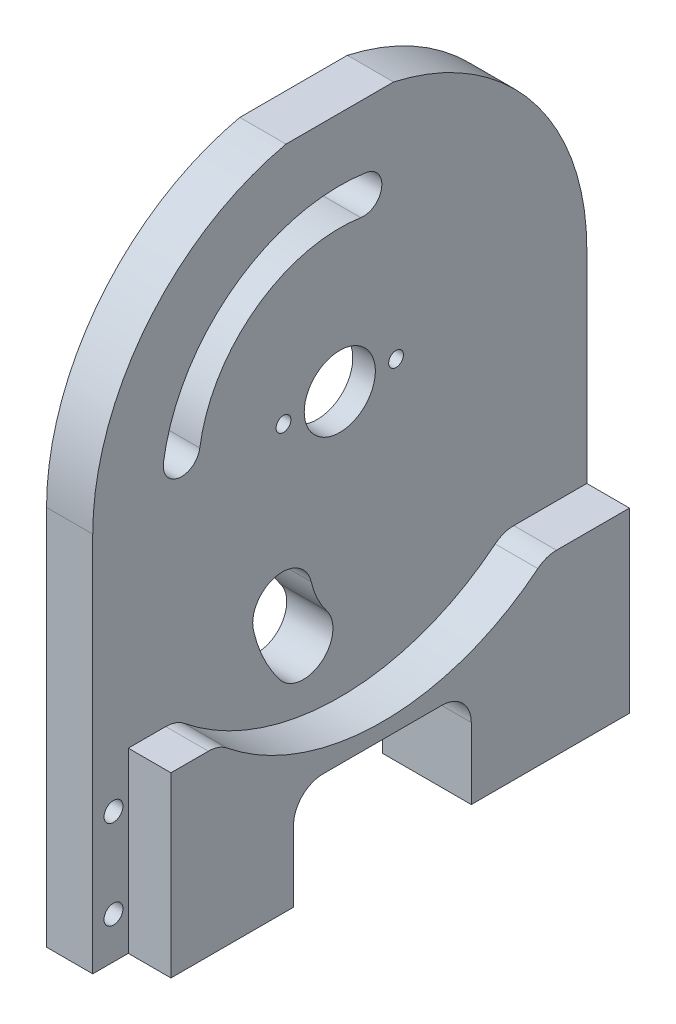
from build123d import *

# Parameters (mm, degrees)
SKETCH_1_W           = 7.8
SKETCH_1_H           = 83.4
EXTRUDE_1_DEPTH      = 105
CUT_EXTRUDE_1_DEPTH  = 135.318278726
SKETCH_3_R           = 6
CUT_EXTRUDE_2_DEPTH  = 135.318278726
SKETCH_4_R           = 13.6
CUT_EXTRUDE_3_DEPTH  = 4
SKETCH_5_R           = 1.25
CUT_EXTRUDE_4_DEPTH  = 4
EXTRUDE_2_DEPTH      = 7.2
SKETCH_7_W           = 6
SKETCH_7_H           = 30
CUT_EXTRUDE_5_DEPTH  = 7.2
CUT_EXTRUDE_6_DEPTH  = 135.92798079
SKETCH_9_R           = 1.65
CUT_EXTRUDE_7_DEPTH  = 15
CUT_EXTRUDE_8_DEPTH  = 135.92798079
FILLET_1_R           = 5
CUT_EXTRUDE_10_DEPTH = 135.92798079
SKETCH_16_R          = 1.6
CUT_EXTRUDE_11_DEPTH = 135.92798079
SKETCH_17_R          = 3
CUT_EXTRUDE_12_DEPTH = 2


with BuildPart() as part:
    # 草图1 → 凸台-拉伸1 (new body)
    with BuildSketch(Plane(origin=(0, 0, 0), x_dir=(1, 0, 0), z_dir=(0, 1, 0))):
        with Locations((3.9, -41.7)):
            Rectangle(SKETCH_1_W, SKETCH_1_H)
    extrude(amount=EXTRUDE_1_DEPTH)

    # 草图2 → 切除-拉伸1 (cut, through all)
    with BuildSketch(Plane.ZY):
        with BuildLine():
            Line((0, 64.3), (0, 105))
            Line((0, 105), (32.622555426, 105))
            ThreePointArc((32.622555426, 105), (9.162180169, 90.380266115), (0, 64.3))
        make_face()
        with BuildLine():
            Line((83.4, 105), (83.4, 64.3))
            ThreePointArc((83.4, 64.3), (74.237819831, 90.380266115), (50.777444574, 105))
            Line((50.777444574, 105), (83.4, 105))
        make_face()
    extrude(amount=-CUT_EXTRUDE_1_DEPTH, mode=Mode.SUBTRACT)

    # 草图3 → 切除-拉伸2 (cut, through all)
    with BuildSketch(Plane.ZY):
        with Locations((41.7, 64.3)):
            Circle(SKETCH_3_R)
    extrude(amount=-CUT_EXTRUDE_2_DEPTH, mode=Mode.SUBTRACT)

    # 草图4 → 切除-拉伸3 (cut)
    with BuildSketch(Plane.ZY):
        with Locations((41.7, 64.3)):
            Circle(SKETCH_4_R)
    extrude(amount=-CUT_EXTRUDE_3_DEPTH, mode=Mode.SUBTRACT)

    # 草图5 → 切除-拉伸4 (cut)
    with BuildSketch(Plane.ZY.offset(-4)):
        with Locations((32.2, 64.3)):
            Circle(SKETCH_5_R)
        with Locations((51.2, 64.3)):
            Circle(SKETCH_5_R)
    extrude(amount=-CUT_EXTRUDE_4_DEPTH, mode=Mode.SUBTRACT)

    # 草图6 → 凸台-拉伸2 (add)
    with BuildSketch(Plane(origin=(7.8, 0, 0), x_dir=(0, 0, -1), z_dir=(1, 0, 0))):
        with BuildLine():
            ThreePointArc((-14.146415841, 30), (-26.974511893, 22.286540784), (-41.7, 19.6))
            Line((-41.7, 19.6), (-41.7, 0))
            Line((-41.7, 0), (0, 0))
            Line((0, 0), (0, 30))
            Line((0, 30), (-14.146415841, 30))
        make_face()
        with BuildLine():
            Line((-41.7, 0), (-41.7, 19.6))
            ThreePointArc((-41.7, 19.6), (-56.425488107, 22.286540784), (-69.253584159, 30))
            Line((-69.253584159, 30), (-83.4, 30))
            Line((-83.4, 30), (-83.4, 0))
            Line((-83.4, 0), (-41.7, 0))
        make_face()
    extrude(amount=EXTRUDE_2_DEPTH)

    # 草图7 → 切除-拉伸5 (cut)
    with BuildSketch(Plane(origin=(15, 0, 0), x_dir=(0, 0, -1), z_dir=(1, 0, 0))):
        with Locations((-80.4, 15)):
            Rectangle(SKETCH_7_W, SKETCH_7_H)
    extrude(amount=-CUT_EXTRUDE_5_DEPTH, mode=Mode.SUBTRACT)

    # 草图8 → 切除-拉伸6 (cut, through all)
    with BuildSketch(Plane.ZY):
        with BuildLine():
            Line((31.7, 17), (51.7, 17))
            ThreePointArc((51.7, 17), (55.235533906, 15.535533906), (56.7, 12))
            Line((56.7, 12), (56.7, 0))
            Line((56.7, 0), (26.7, 0))
            Line((26.7, 0), (26.7, 12))
            ThreePointArc((26.7, 12), (28.164466094, 15.535533906), (31.7, 17))
        make_face()
    extrude(amount=-CUT_EXTRUDE_6_DEPTH, mode=Mode.SUBTRACT)

    # 草图9 → 切除-拉伸7 (cut)
    with BuildSketch(Plane.XZ):
        with Locations(Location((7.5, 73.4, 0), (0, 0, 270))):
            Circle(SKETCH_9_R)
        with Locations(Location((7.5, 62.7, 0), (0, 0, 270))):
            Circle(SKETCH_9_R)
        with Locations(Location((7.5, 20.7, 0), (0, 0, 270))):
            Circle(SKETCH_9_R)
        with Locations(Location((7.5, 6, 0), (0, 0, 270))):
            Circle(SKETCH_9_R)
    extrude(amount=-CUT_EXTRUDE_7_DEPTH, mode=Mode.SUBTRACT)

    # 草图10 → 切除-拉伸8 (cut, through all)
    with BuildSketch(Plane.ZY):
        with BuildLine():
            ThreePointArc((71.465786865, 68.759293912), (59.594392775, 88.500786704), (37.240706088, 94.065786865))
            ThreePointArc((37.240706088, 94.065786865), (34.634213135, 90.540706088), (38.159293912, 87.934213135))
            ThreePointArc((38.159293912, 87.934213135), (55.908255091, 83.51556966), (65.334213135, 67.840706088))
            ThreePointArc((65.334213135, 67.840706088), (68.859293912, 65.234213135), (71.465786865, 68.759293912))
        make_face()
    extrude(amount=-CUT_EXTRUDE_8_DEPTH, mode=Mode.SUBTRACT)

    # 圆角1
    fillet_1_edges = [part.edges().sort_by_distance(p)[0] for p in [
        (11.4, 30, 14.146415841),
        (11.4, 30, 69.253584159),
    ]]
    fillet(fillet_1_edges, radius=FILLET_1_R)

    # 草图15 → 切除-拉伸10 (cut, through all)
    with BuildSketch(Plane.ZY):
        with BuildLine():
            ThreePointArc((51.819846568, 27.213416986), (54.551104159, 31.68578749), (56.268755758, 36.63670043))
            ThreePointArc((56.268755758, 36.63670043), (52.521049565, 42.632924099), (46.524825896, 38.885217906))
            ThreePointArc((46.524825896, 38.885217906), (45.508256582, 35.955085758), (43.891798008, 33.308172603))
            ThreePointArc((43.891798008, 33.308172603), (44.80844448, 26.296770514), (51.819846568, 27.213416986))
        make_face()
    extrude(amount=-CUT_EXTRUDE_10_DEPTH, mode=Mode.SUBTRACT)

    # 草图16 → 切除-拉伸11 (cut, through all)
    with BuildSketch(Plane.ZY):
        with Locations((79.9, 7)):
            Circle(SKETCH_16_R)
        with Locations((79.9, 22)):
            Circle(SKETCH_16_R)
    extrude(amount=-CUT_EXTRUDE_11_DEPTH, mode=Mode.SUBTRACT)

    # 草图17 → 切除-拉伸12 (cut)
    with BuildSketch(Plane.ZY):
        with Locations((79.9, 7)):
            Circle(SKETCH_17_R)
        with Locations((79.9, 22)):
            Circle(SKETCH_17_R)
    extrude(amount=-CUT_EXTRUDE_12_DEPTH, mode=Mode.SUBTRACT)


solid = part.part
